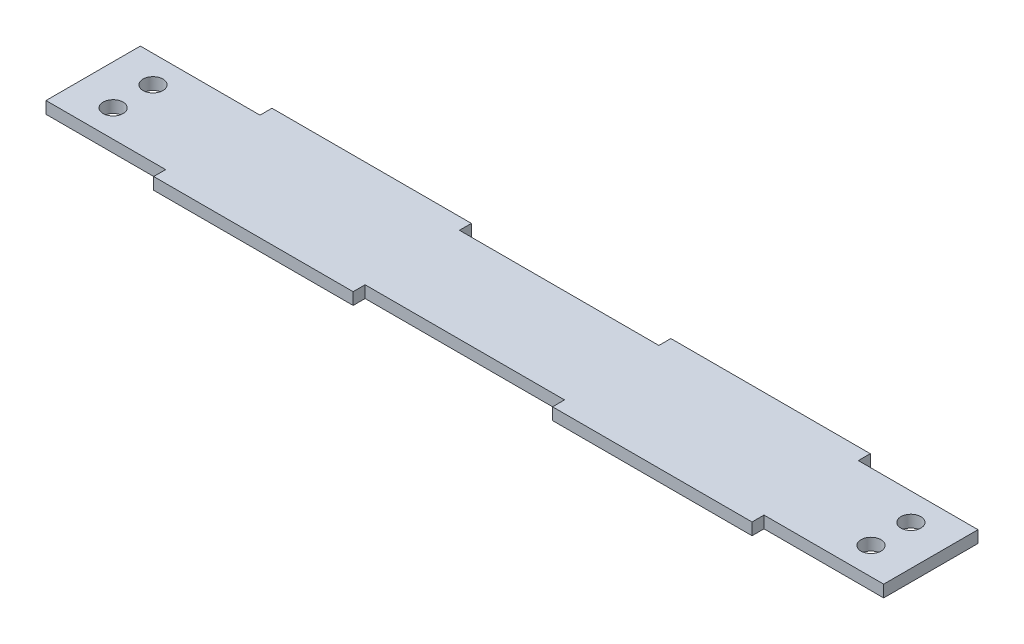
from build123d import *

# Parameters (mm, degrees)
SKETCH1_R           = 2.5
BOSS_EXTRUDE1_DEPTH = 3


with BuildPart() as part:
    # Sketch1 → Boss-Extrude1 (new body)
    with BuildSketch(Plane(origin=(0, 0, 0), x_dir=(1, 0, 0), z_dir=(0, 1, 0))):
        Polygon((-105, -11.825), (-75, -11.825), (-75, -14.825), (-25, -14.825), (-25, -11.825), (25, -11.825), (25, -14.825), (75, -14.825), (75, -11.825), (105, -11.825), (105, 11.825), (75, 11.825), (75, 14.825), (25, 14.825), (25, 11.825), (-25, 11.825), (-25, 14.825), (-75, 14.825), (-75, 11.825), (-105, 11.825), align=None)
        with Locations(Location((-95, 5, 0), (0, 0, 270))):
            Circle(SKETCH1_R, mode=Mode.SUBTRACT)
        with Locations(Location((-95, -5, 0), (0, 0, 270))):
            Circle(SKETCH1_R, mode=Mode.SUBTRACT)
        with Locations(Location((95, 5, 0), (0, 0, 270))):
            Circle(SKETCH1_R, mode=Mode.SUBTRACT)
        with Locations(Location((95, -5, 0), (0, 0, 270))):
            Circle(SKETCH1_R, mode=Mode.SUBTRACT)
    extrude(amount=BOSS_EXTRUDE1_DEPTH)


solid = part.part
